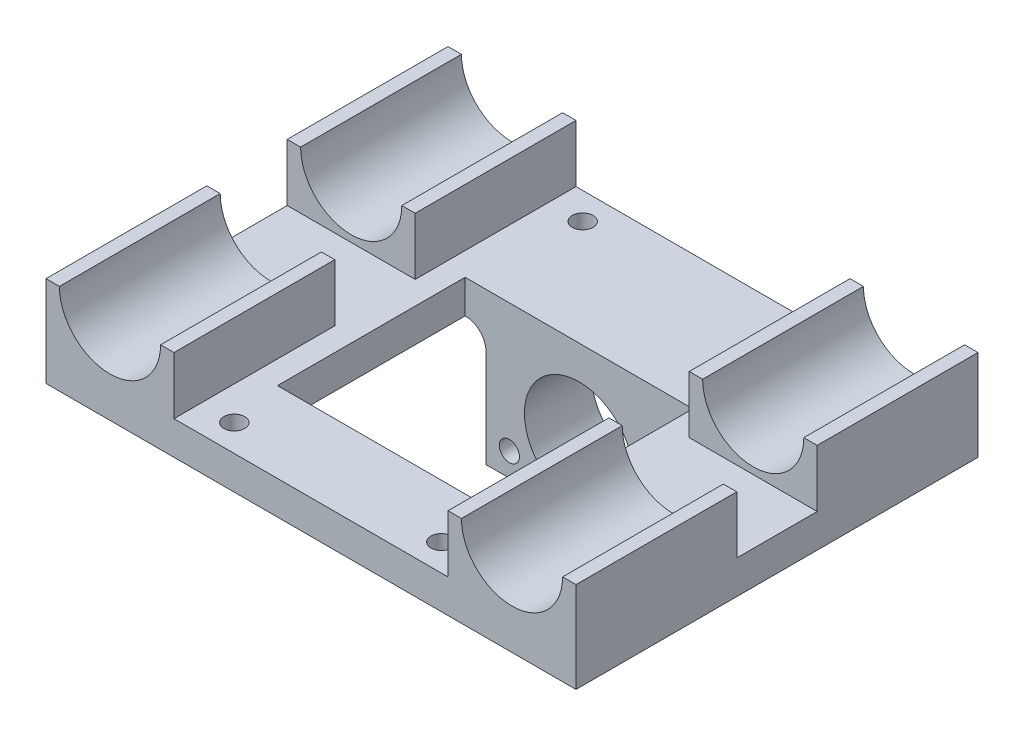
from build123d import *

# Parameters (mm, degrees)
SKETCH1_W            = 79.1
SKETCH1_H            = 60
BOSS_EXTRUDE1_DEPTH  = 5
BOSS_EXTRUDE2_DEPTH  = 24
MIRROR2_COPY_1_DEPTH = 24
SKETCH10_R           = 1.55
CUT_EXTRUDE7_DEPTH   = 8
SKETCH11_R           = 3
CUT_EXTRUDE8_DEPTH   = 1
SKETCH12_W           = 27.78460969
SKETCH12_H           = 17.653
SKETCH12_R           = 1.5
SKETCH12_R_2         = 8.15
BOSS_EXTRUDE5_DEPTH  = 10
SKETCH13_W           = 34
SKETCH13_H           = 28
CUT_EXTRUDE9_DEPTH   = 10
FILLET2_R            = 3
SKETCH15_W           = 6
SKETCH15_H           = 2.8
CUT_EXTRUDE12_DEPTH  = 8.2


with BuildPart() as part:
    # Sketch1 → Boss-Extrude1 (new body)
    with BuildSketch(Plane(origin=(0, 0, 0), x_dir=(1, 0, 0), z_dir=(0, 1, 0))):
        Rectangle(SKETCH1_W, SKETCH1_H)
    extrude(amount=BOSS_EXTRUDE1_DEPTH)

    # Sketch2 → Boss-Extrude2 (add)
    with BuildSketch(Plane.XY.offset(30)):
        with BuildLine():
            Line((-39.55, 13.55), (-39.55, 5))
            Line((-39.55, 5), (-20.45, 5))
            Line((-20.45, 5), (-20.45, 13.55))
            Line((-20.45, 13.55), (-22.45, 13.55))
            ThreePointArc((-22.45, 13.55), (-30, 6), (-37.55, 13.55))
            Line((-37.55, 13.55), (-39.55, 13.55))
        make_face()
    boss_extrude2 = extrude(amount=-BOSS_EXTRUDE2_DEPTH)

    # Mirror1: Boss-Extrude2 across plane
    add(boss_extrude2.mirror(Plane.XY))

    # Mirror2: Boss-Extrude2 across plane
    add(boss_extrude2.mirror(Plane(origin=(0, 0, 0), x_dir=(0, 0, 1), z_dir=(1, 0, 0))))

    # Mirror2 copy 1 sketch → Mirror2 copy 1 (add)
    with BuildSketch(Plane(origin=(0, 0, -30), x_dir=(-1, 0, 0), z_dir=(0, 0, -1))):
        with BuildLine():
            Line((-39.55, 13.55), (-39.55, 5))
            Line((-39.55, 5), (-20.45, 5))
            Line((-20.45, 5), (-20.45, 13.55))
            Line((-20.45, 13.55), (-22.45, 13.55))
            ThreePointArc((-22.45, 13.55), (-30, 6), (-37.55, 13.55))
            Line((-37.55, 13.55), (-39.55, 13.55))
        make_face()
    extrude(amount=-MIRROR2_COPY_1_DEPTH)

    # Sketch10 → Cut-Extrude7 (cut)
    with BuildSketch(Plane(origin=(0, 5, 0), x_dir=(1, 0, 0), z_dir=(0, 1, 0))):
        with Locations(Location((-15.45, -26, 0), (0, 0, 270))):
            Circle(SKETCH10_R)
        with Locations(Location((-15.45, 26, 0), (0, 0, 270))):
            Circle(SKETCH10_R)
        with Locations(Location((15.45, 26, 0), (0, 0, 270))):
            Circle(SKETCH10_R)
        with Locations(Location((15.45, -26, 0), (0, 0, 270))):
            Circle(SKETCH10_R)
    extrude(amount=-CUT_EXTRUDE7_DEPTH, mode=Mode.SUBTRACT)

    # Sketch11 → Cut-Extrude8 (cut)
    with BuildSketch(Plane.XZ):
        with Locations(Location((-15.45, 26, 0), (0, 0, 270))):
            Circle(SKETCH11_R)
        with Locations(Location((15.45, 26, 0), (0, 0, 270))):
            Circle(SKETCH11_R)
        with Locations(Location((15.45, -26, 0), (0, 0, 270))):
            Circle(SKETCH11_R)
        with Locations(Location((-15.45, -26, 0), (0, 0, 270))):
            Circle(SKETCH11_R)
    extrude(amount=-CUT_EXTRUDE8_DEPTH, mode=Mode.SUBTRACT)

    # Sketch12 → Boss-Extrude5 (add)
    with BuildSketch(Plane.XY.offset(-10)):
        with Locations((0, -8.8265)):
            Rectangle(SKETCH12_W, SKETCH12_H)
        with Locations(Location((-10.392304845, -14.153, 0), (0, 0, 180))):
            Circle(SKETCH12_R, mode=Mode.SUBTRACT)
        with Locations(Location((10.392304845, -14.153, 0), (0, 0, 180))):
            Circle(SKETCH12_R, mode=Mode.SUBTRACT)
        with Locations(Location((0, -8.153, 0), (0, 0, 180))):
            Circle(SKETCH12_R_2, mode=Mode.SUBTRACT)
    extrude(amount=-BOSS_EXTRUDE5_DEPTH)

    # Sketch13 → Cut-Extrude9 (cut)
    with BuildSketch(Plane.XZ):
        with Locations((0, 4)):
            Rectangle(SKETCH13_W, SKETCH13_H)
    extrude(amount=-CUT_EXTRUDE9_DEPTH, mode=Mode.SUBTRACT)

    # Fillet2
    fillet2_edges = [part.edges().sort_by_distance(p)[0] for p in [
        (-13.892304845, 0, -15),
        (13.892304845, 0, -15),
    ]]
    fillet(fillet2_edges, radius=FILLET2_R)

    # Sketch15 → Cut-Extrude12 (cut)
    with BuildSketch(Plane(origin=(-15.772652423, -15.772652423, 0), x_dir=(-0.7071067811865477, 0.7071067811865475, 0), z_dir=(-0.7071067811865475, -0.7071067811865477, 0))):
        with Locations((-2.659213046, 13.9)):
            Rectangle(SKETCH15_W, SKETCH15_H)
    cut_extrude12 = extrude(amount=-CUT_EXTRUDE12_DEPTH, mode=Mode.SUBTRACT)

    # Mirror3: Cut-Extrude12 across plane
    add(cut_extrude12.mirror(Plane(origin=(0, 0, 0), x_dir=(0, 0, 1), z_dir=(1, 0, 0))), mode=Mode.SUBTRACT)


solid = part.part
